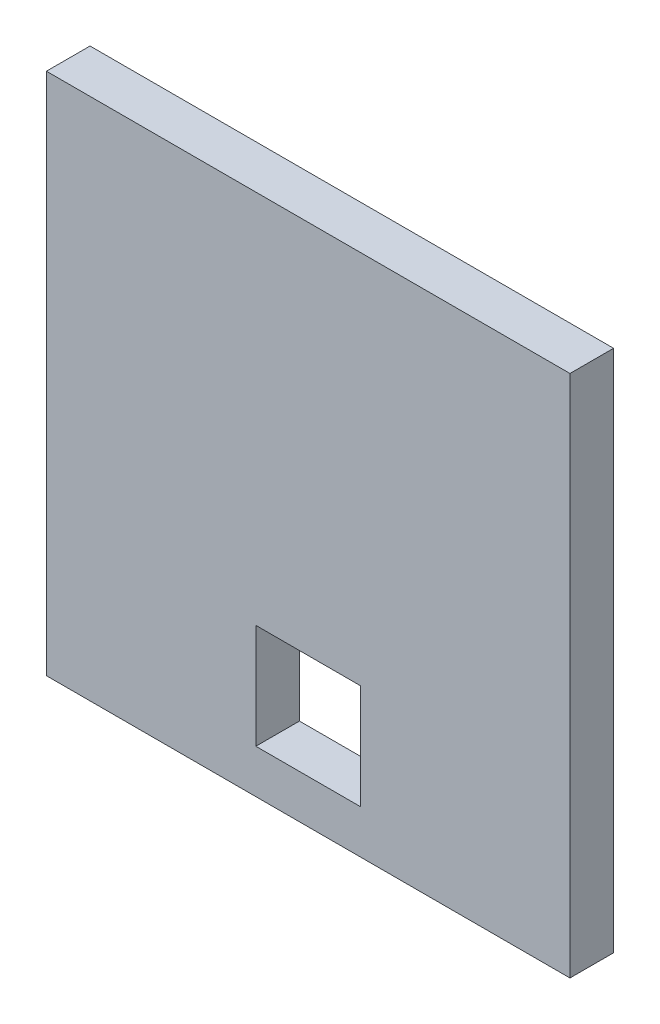
from build123d import *

# Parameters (mm, degrees)
SKETCH2_W           = 38.1
SKETCH2_H           = 38.1
BOSS_EXTRUDE1_DEPTH = 3.175
SKETCH8_W           = 7.62
SKETCH8_H           = 7.62
CUT_EXTRUDE2_DEPTH  = 54.975


with BuildPart() as part:
    # Sketch2 → Boss-Extrude1 (new body)
    with BuildSketch(Plane.XY):
        with Locations((19.05, 19.05)):
            Rectangle(SKETCH2_W, SKETCH2_H)
    extrude(amount=BOSS_EXTRUDE1_DEPTH)

    # Sketch8 → Cut-Extrude2 (cut, through all)
    with BuildSketch(Plane.XY.offset(3.175)):
        with Locations((19.05, 6.985)):
            Rectangle(SKETCH8_W, SKETCH8_H)
    extrude(amount=-CUT_EXTRUDE2_DEPTH, mode=Mode.SUBTRACT)


solid = part.part
